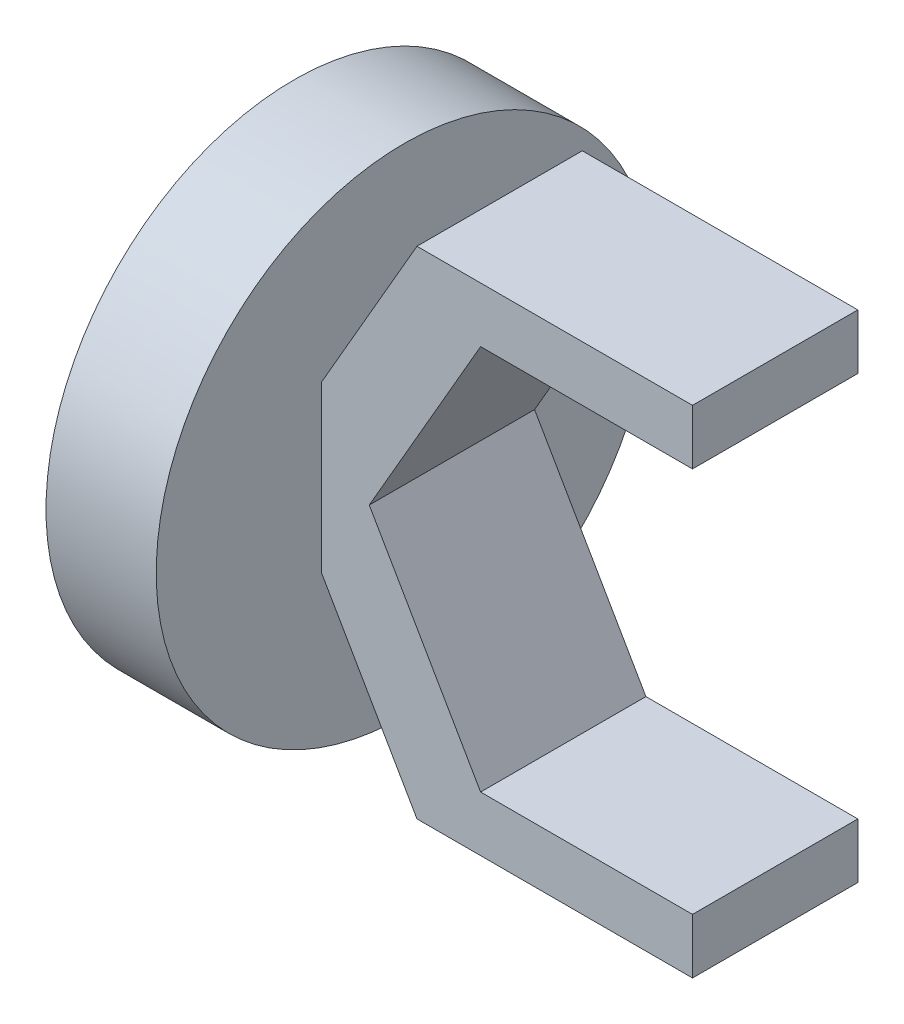
from build123d import *

# Parameters (mm, degrees)
SKETCH1_R                = 45
SKETCH1_R_2              = 10
BOSS_EXTRUDE1_DEPTH      = 20
BOSS_EXTRUDE2_DEPTH      = 15
BOSS_EXTRUDE2_DEPTH_BACK = 15


with BuildPart() as part:
    # Sketch1 → Boss-Extrude1 (new body)
    with BuildSketch(Plane(origin=(0, 0, 0), x_dir=(0, 0, -1), z_dir=(1, 0, 0))):
        Circle(SKETCH1_R)
        Circle(SKETCH1_R_2, mode=Mode.SUBTRACT)
    extrude(amount=BOSS_EXTRUDE1_DEPTH)

    # Sketch4 → Boss-Extrude2 (add, two sides: drawn at the far end of the back side and taken through both)
    with BuildSketch(Plane.XY.offset(-BOSS_EXTRUDE2_DEPTH_BACK)):
        Polygon((20, -15), (37.320508076, -45), (87.320508076, -45), (87.320508076, -35), (48.867513459, -35), (28.660254038, 0), (48.867513459, 35), (87.320508076, 35), (87.320508076, 45), (37.320508076, 45), (20, 15), align=None)
    extrude(amount=BOSS_EXTRUDE2_DEPTH + BOSS_EXTRUDE2_DEPTH_BACK)


solid = part.part
